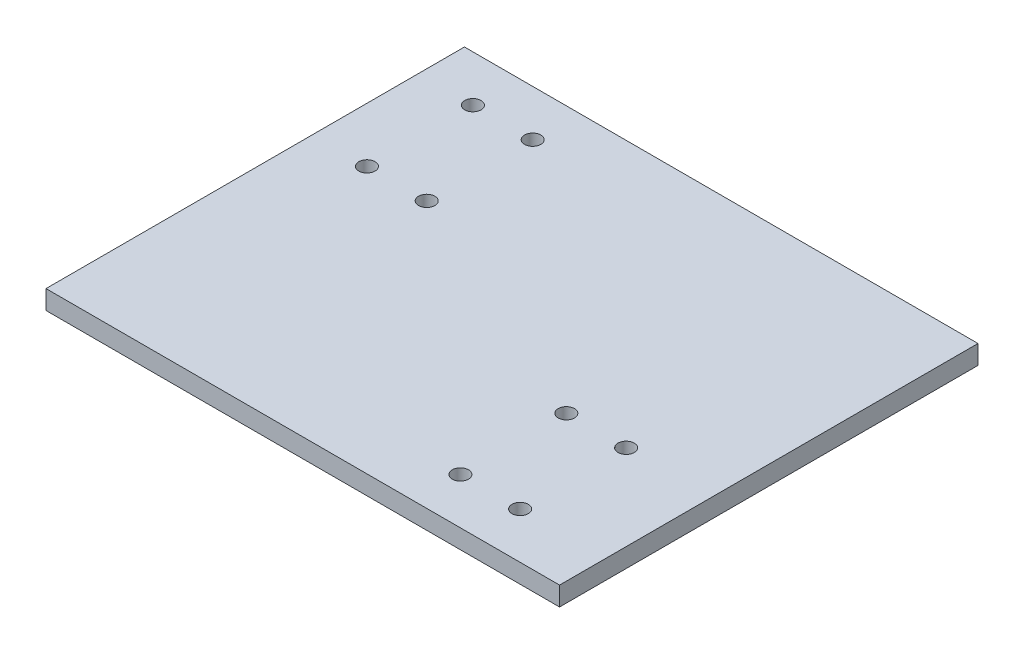
from build123d import *

# Parameters (mm, degrees)
SKETCH1_R           = 3
BOSS_EXTRUDE1_DEPTH = 7


with BuildPart() as part:
    # Sketch1 → Boss-Extrude1 (new body)
    with BuildSketch(Plane(origin=(0, 0, 0), x_dir=(1, 0, 0), z_dir=(0, 1, 0))):
        Polygon((30, -77), (94.5, -77), (94.5, 77), (-85.39, 77), (-94.5, 77), (-94.5, -77), align=None)
        with Locations(Location((41, -60, 0), (0, 0, 270))):
            Circle(SKETCH1_R, mode=Mode.SUBTRACT)
        with Locations(Location((63, -60, 0), (0, 0, 270))):
            Circle(SKETCH1_R, mode=Mode.SUBTRACT)
        with Locations(Location((41, -21, 0), (0, 0, 270))):
            Circle(SKETCH1_R, mode=Mode.SUBTRACT)
        with Locations(Location((63, -21, 0), (0, 0, 270))):
            Circle(SKETCH1_R, mode=Mode.SUBTRACT)
        with Locations(Location((-74.39, 21, 0), (0, 0, 270))):
            Circle(SKETCH1_R, mode=Mode.SUBTRACT)
        with Locations(Location((-52.39, 21, 0), (0, 0, 270))):
            Circle(SKETCH1_R, mode=Mode.SUBTRACT)
        with Locations(Location((-74.39, 60, 0), (0, 0, 270))):
            Circle(SKETCH1_R, mode=Mode.SUBTRACT)
        with Locations(Location((-52.39, 60, 0), (0, 0, 270))):
            Circle(SKETCH1_R, mode=Mode.SUBTRACT)
    extrude(amount=BOSS_EXTRUDE1_DEPTH)


solid = part.part
